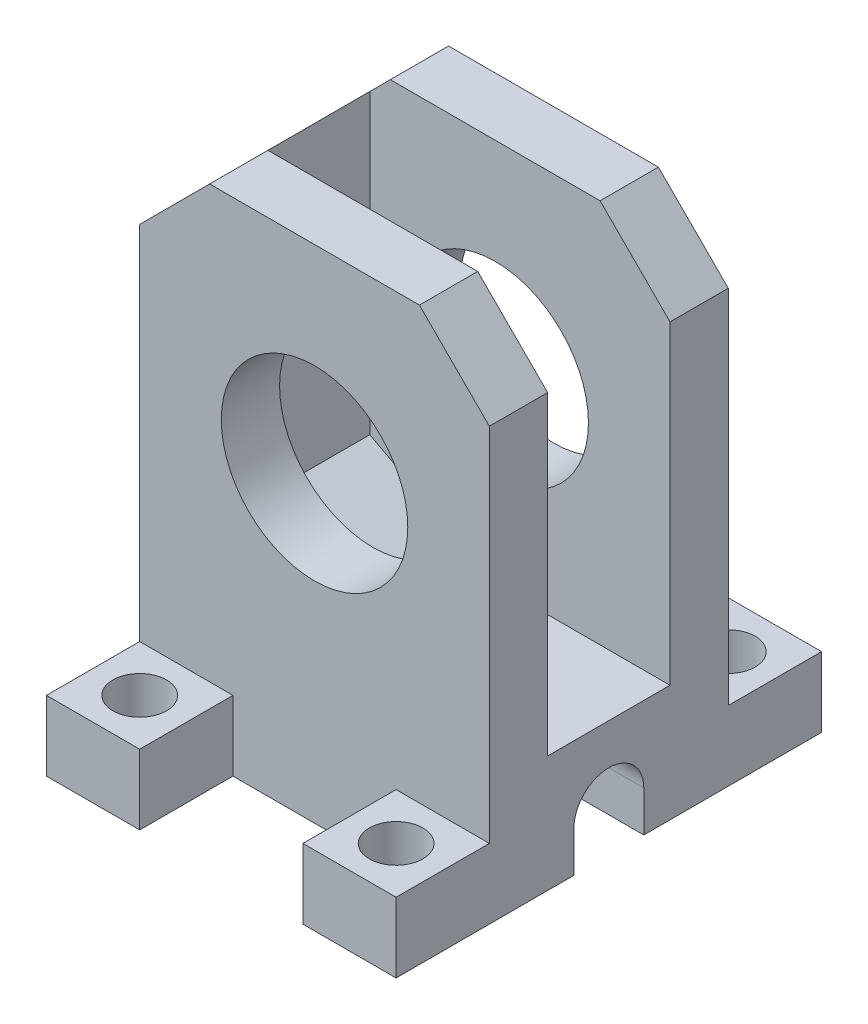
from build123d import *

# Parameters (mm, degrees)
ESQUISSE1_R             = 8
BOSS_EXTRU_1_DEPTH      = 5
ESQUISSE2_W             = 30
ESQUISSE2_H             = 12
BOSS_EXTRU_2_DEPTH      = 10.5
ESQUISSE4_W             = 30
ESQUISSE4_H             = 5
BOSS_EXTRU_3_DEPTH      = 45
ENL_V_START             = -10
ESQUISSE6_R             = 8
ENL_V_MAT_EXTRU_3_DEPTH = 10
ESQUISSE8_W             = 8
ESQUISSE8_H             = 8
ESQUISSE8_R             = 2.3
BOSS_EXTRU_4_DEPTH      = 8
ENL_V_MAT_EXTRU_4_DEPTH = 2
ENL_V_MAT_EXTRU_5_DEPTH = 50
ENL_V_MAT_EXTRU_6_DEPTH = 50
BOSS_EXTRU_5_DEPTH      = 10.5
BOSS_EXTRU_7_DEPTH      = 15


with BuildPart() as part:
    # Esquisse1 → Boss.-Extru.1 (new body)
    with BuildSketch(Plane.XY):
        Polygon((0, 0), (15, 0), (15, 45), (-15, 45), (-15, 0), align=None)
        with Locations((0, 28)):
            Circle(ESQUISSE1_R, mode=Mode.SUBTRACT)
    extrude(amount=-BOSS_EXTRU_1_DEPTH)

    # Esquisse2 → Boss.-Extru.2 (add)
    with BuildSketch(Plane(origin=(0, 0, -5), x_dir=(-1, 0, 0), z_dir=(0, 0, -1))):
        with Locations((0, 6)):
            Rectangle(ESQUISSE2_W, ESQUISSE2_H)
    extrude(amount=BOSS_EXTRU_2_DEPTH)

    # Esquisse4 → Boss.-Extru.3 (add)
    with BuildSketch(Plane.XZ):
        with Locations((0, -18)):
            Rectangle(ESQUISSE4_W, ESQUISSE4_H)
    extrude(amount=-BOSS_EXTRU_3_DEPTH)

    # Esquisse6 → Enlèv. mat.-Extru.3 (cut)
    with BuildSketch(Plane(origin=(0, 0, -20.5), x_dir=(-1, 0, 0), z_dir=(0, 0, -1)).offset(ENL_V_START)):
        with Locations(Location((0, 28, 0), (0, 0, 180))):
            Circle(ESQUISSE6_R)
    extrude(amount=ENL_V_MAT_EXTRU_3_DEPTH, mode=Mode.SUBTRACT)

    # Esquisse8 → Boss.-Extru.4 (add)
    # profile 1 of 4: a face of its own
    with BuildSketch(Plane.XZ):
        with Locations((-11, 4)):
            Rectangle(ESQUISSE8_W, ESQUISSE8_H)
        with Locations(Location((-11, 4, 0), (0, 0, 270))):
            Circle(ESQUISSE8_R, mode=Mode.SUBTRACT)
    # profile 2 of 4: a face of its own
    with BuildSketch(Plane.XZ):
        with Locations((11, 4)):
            Rectangle(ESQUISSE8_W, ESQUISSE8_H)
        with Locations(Location((11, 4, 0), (0, 0, 270))):
            Circle(ESQUISSE8_R, mode=Mode.SUBTRACT)
    # profile 3 of 4: a face of its own
    with BuildSketch(Plane.XZ):
        with Locations((-11, -24.5)):
            Rectangle(ESQUISSE8_W, ESQUISSE8_H)
        with Locations(Location((-11, -24.5, 0), (0, 0, 270))):
            Circle(ESQUISSE8_R, mode=Mode.SUBTRACT)
    # profile 4 of 4: a face of its own
    with BuildSketch(Plane.XZ):
        with Locations((11, -24.5)):
            Rectangle(ESQUISSE8_W, ESQUISSE8_H)
        with Locations(Location((11, -24.5, 0), (0, 0, 270))):
            Circle(ESQUISSE8_R, mode=Mode.SUBTRACT)
    extrude(amount=-BOSS_EXTRU_4_DEPTH)

    # Esquisse9 → Enlèv. mat.-Extru.4 (cut)
    with BuildSketch(Plane.XZ):
        Polygon((-15, 8), (-15, -28.5), (-7, -28.5), (-7, -20.5), (7, -20.5), (7, -28.5), (15, -28.5), (15, 8), (7, 8), (7, 0), (-7, 0), (-7, 8), align=None)
    extrude(amount=-ENL_V_MAT_EXTRU_4_DEPTH, mode=Mode.SUBTRACT)

    # Esquisse10 → Enlèv. mat.-Extru.5 (cut)
    with BuildSketch(Plane.ZY.offset(15)):
        with BuildLine():
            Line((-13.25, 2), (-7.25, 2))
            Line((-7.25, 2), (-7.25, 5.5))
            ThreePointArc((-7.25, 5.5), (-10.25, 8.5), (-13.25, 5.5))
            Line((-13.25, 5.5), (-13.25, 2))
        make_face()
    extrude(amount=-ENL_V_MAT_EXTRU_5_DEPTH, mode=Mode.SUBTRACT)

    # Esquisse11 → Enlèv. mat.-Extru.6 (cut)
    with BuildSketch(Plane.XY):
        Polygon((-9, 45), (-15, 45), (-15, 39), align=None)
        Polygon((15, 45), (9, 45), (15, 39), align=None)
    extrude(amount=-ENL_V_MAT_EXTRU_6_DEPTH, mode=Mode.SUBTRACT)

    # Esquisse12 → Boss.-Extru.5 (add)
    with BuildSketch(Plane(origin=(0, 0, -5), x_dir=(-1, 0, 0), z_dir=(0, 0, -1))):
        Polygon((0, 12), (15, 12), (15, 20), align=None)
    extrude(amount=BOSS_EXTRU_5_DEPTH)

    # Esquisse13 → Boss.-Extru.7 (add)
    with BuildSketch(Plane.XY.offset(-15.5)):
        Polygon((-15, 20), (-15, 39), (-10.757359313, 43.242640687), (-10.757359313, 17.084037873), align=None)
    extrude(amount=BOSS_EXTRU_7_DEPTH)


solid = part.part
